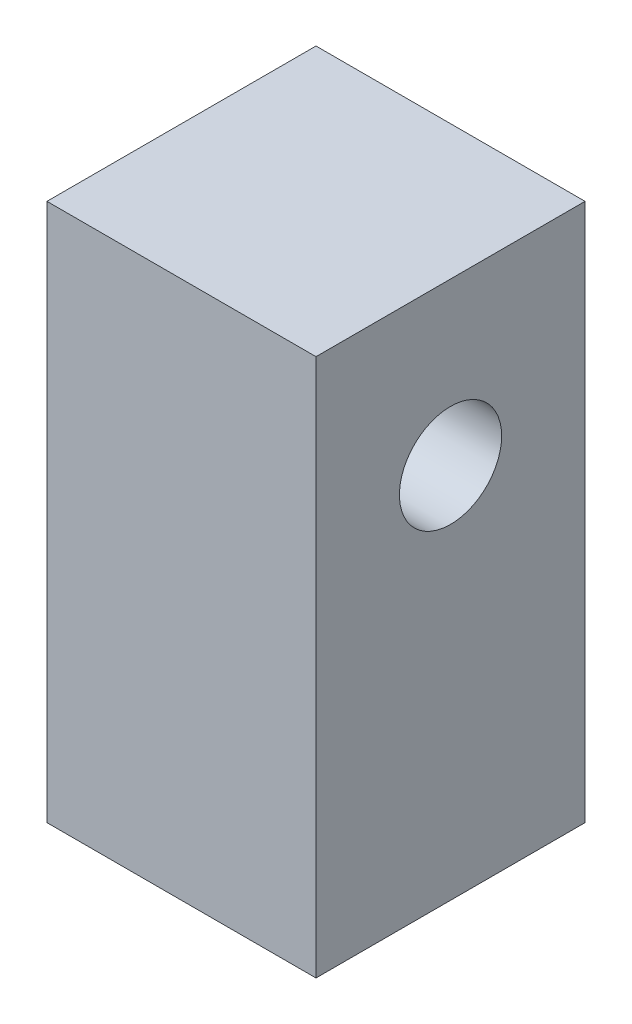
from build123d import *

# Parameters (mm, degrees)
SKETCH1_W           = 12.7
SKETCH1_H           = 12.7
BOSS_EXTRUDE1_DEPTH = 25.4
SKETCH2_R           = 2.413
CUT_EXTRUDE1_DEPTH  = 30.099355663


with BuildPart() as part:
    # Sketch1 → Boss-Extrude1 (new body)
    with BuildSketch(Plane(origin=(0, 0, 0), x_dir=(1, 0, 0), z_dir=(0, 1, 0))):
        Rectangle(SKETCH1_W, SKETCH1_H)
    extrude(amount=BOSS_EXTRUDE1_DEPTH)

    # Sketch2 → Cut-Extrude1 (cut, through all)
    with BuildSketch(Plane(origin=(6.35, 0, 0), x_dir=(0, 0, -1), z_dir=(1, 0, 0))):
        with Locations((0, 17.78)):
            Circle(SKETCH2_R)
    extrude(amount=-CUT_EXTRUDE1_DEPTH, mode=Mode.SUBTRACT)


solid = part.part
